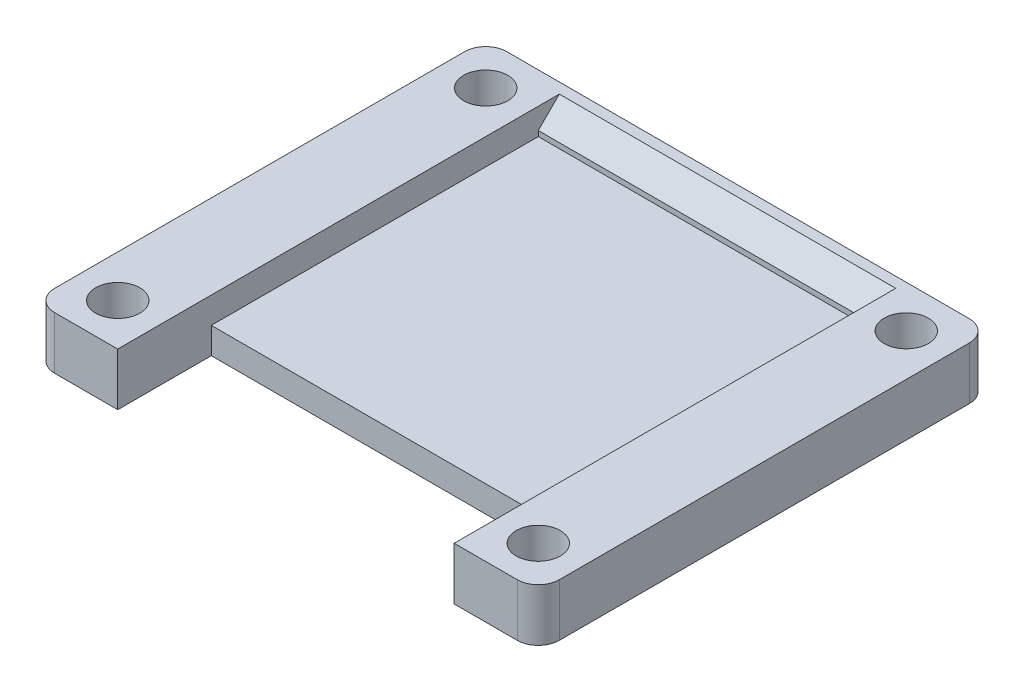
from build123d import *

# Parameters (mm, degrees)
SKETCH_1_W          = 48
SKETCH_1_H          = 43
EXTRUDE_1_DEPTH     = 5
SKETCH_2_W          = 32
SKETCH_2_H          = 40
CUT_EXTRUDE_1_DEPTH = 2.5
SKETCH_3_R          = 2.1
CUT_EXTRUDE_2_DEPTH = 65.637450445
FILLET_1_R          = 2
CHAMFER_2_SIZE      = 2
SKETCH_4_W          = 32
SKETCH_4_H          = 8.9
CUT_EXTRUDE_3_DEPTH = 65.492247596


with BuildPart() as part:
    # Эскиз1 → Бобышка-Вытянуть1 (new body)
    with BuildSketch(Plane(origin=(0, 0, 0), x_dir=(1, 0, 0), z_dir=(0, 1, 0))):
        with Locations((-24, 21.5)):
            Rectangle(SKETCH_1_W, SKETCH_1_H)
    extrude(amount=-EXTRUDE_1_DEPTH)

    # Эскиз2 → Вырез-Вытянуть1 (cut)
    with BuildSketch(Plane(origin=(0, 0, 0), x_dir=(1, 0, 0), z_dir=(0, 1, 0))):
        with Locations((-24, 20)):
            Rectangle(SKETCH_2_W, SKETCH_2_H)
    extrude(amount=-CUT_EXTRUDE_1_DEPTH, mode=Mode.SUBTRACT)

    # Эскиз3 → Вырез-Вытянуть2 (cut, through all)
    with BuildSketch(Plane(origin=(0, 0, 0), x_dir=(1, 0, 0), z_dir=(0, 1, 0))):
        with Locations(Location((-44, 39, 0), (0, 0, 270))):
            Circle(SKETCH_3_R)
        with Locations(Location((-4, 39, 0), (0, 0, 90))):
            Circle(SKETCH_3_R)
        with Locations(Location((-4, 4, 0), (0, 0, 270))):
            Circle(SKETCH_3_R)
        with Locations(Location((-44, 4, 0), (0, 0, 90))):
            Circle(SKETCH_3_R)
    extrude(amount=-CUT_EXTRUDE_2_DEPTH, mode=Mode.SUBTRACT)

    # Скругление1
    fillet_1_edges = [part.edges().sort_by_distance(p)[0] for p in [
        (-48, -2.5, -43),
        (0, -2.5, -43),
        (0, -2.5, 0),
        (-48, -2.5, 0),
    ]]
    fillet(fillet_1_edges, radius=FILLET_1_R)

    # Фаска2
    chamfer_2_edges = [part.edges().sort_by_distance(p)[0] for p in [
        (-24, 0, -40),
    ]]
    chamfer(chamfer_2_edges, length=CHAMFER_2_SIZE)

    # Эскиз4 → Вырез-Вытянуть3 (cut, through all)
    with BuildSketch(Plane(origin=(0, -2.5, 0), x_dir=(1, 0, 0), z_dir=(0, 1, 0))):
        with Locations((-24, 4.45)):
            Rectangle(SKETCH_4_W, SKETCH_4_H)
    extrude(amount=-CUT_EXTRUDE_3_DEPTH, mode=Mode.SUBTRACT)


solid = part.part
